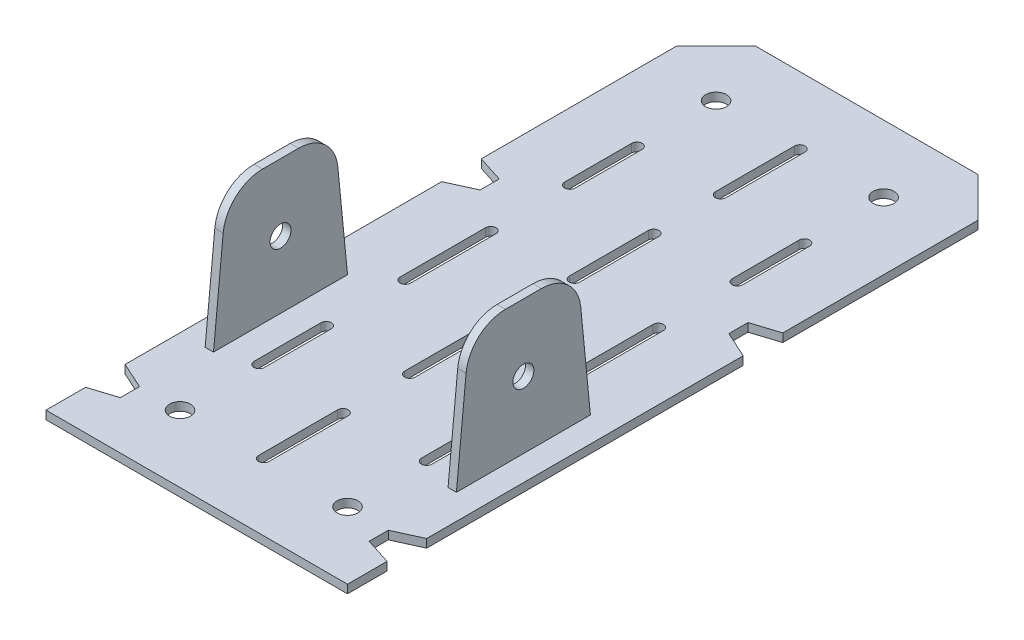
from build123d import *

# Parameters (mm, degrees)
SKETCH1_W           = 114.3
SKETCH1_H           = 254
BOSS_EXTRUDE1_DEPTH = 1.5875
SKETCH2_W           = 3.175
SKETCH2_H           = 50.8
BOSS_EXTRUDE2_DEPTH = 50.8
CUT_EXTRUDE1_DEPTH  = 50
SKETCH4_R           = 3.96875
CUT_EXTRUDE2_DEPTH  = 50
SKETCH5_R           = 3.96875
CUT_EXTRUDE3_DEPTH  = 100
CHAMFER1_SIZE       = 15
FILLET1_R           = 15


with BuildPart() as part:
    # Sketch1 → Boss-Extrude1 (new, symmetric)
    with BuildSketch(Plane(origin=(0, 0, 0), x_dir=(1, 0, 0), z_dir=(0, 1, 0))):
        Rectangle(SKETCH1_W, SKETCH1_H)
    extrude(amount=BOSS_EXTRUDE1_DEPTH, both=True)

    # Sketch2 → Boss-Extrude2 (add)
    with BuildSketch(Plane(origin=(0, 1.5875, 0), x_dir=(1, 0, 0), z_dir=(0, 1, 0))):
        with Locations((46.0375, -50.8)):
            Rectangle(SKETCH2_W, SKETCH2_H)
        with Locations((-46.0375, -50.8)):
            Rectangle(SKETCH2_W, SKETCH2_H)
    extrude(amount=BOSS_EXTRUDE2_DEPTH)

    # Sketch3 → Cut-Extrude1 (cut, symmetric)
    with BuildSketch(Plane(origin=(0, 0, 0), x_dir=(0, 0, -1), z_dir=(1, 0, 0))):
        Polygon((-25.4, 1.5875), (-25.4, 52.3875), (-30.4, 52.3875), align=None)
        Polygon((-76.2, 52.3875), (-71.2, 52.3875), (-76.2, 1.5875), align=None)
    extrude(amount=CUT_EXTRUDE1_DEPTH, both=True, mode=Mode.SUBTRACT)

    # Sketch4 → Cut-Extrude2 (cut, symmetric)
    with BuildSketch(Plane(origin=(0, 0, 0), x_dir=(0, 0, -1), z_dir=(1, 0, 0))):
        with Locations((-50.8, 26.9875)):
            Circle(SKETCH4_R)
    extrude(amount=CUT_EXTRUDE2_DEPTH, both=True, mode=Mode.SUBTRACT)

    # Sketch5 → Cut-Extrude3 (cut)
    with BuildSketch(Plane(origin=(0, 1.5875, 0), x_dir=(1, 0, 0), z_dir=(0, 1, 0))):
        with Locations(Location((31.75, -101.6, 0), (0, 0, 270))):
            Circle(SKETCH5_R)
        with Locations(Location((-31.75, -101.6, 0), (0, 0, 270))):
            Circle(SKETCH5_R)
        with Locations(Location((31.75, 101.6, 0), (0, 0, 270))):
            Circle(SKETCH5_R)
        with Locations(Location((-31.75, 101.6, 0), (0, 0, 270))):
            Circle(SKETCH5_R)
        with Locations(Location((0, 0, 0), (0, 0, 270))):
            Circle(SKETCH5_R)
        with BuildLine():
            Line((-1.984375, -101.6), (-1.984375, -71.6))
            ThreePointArc((-1.984375, -71.6), (0, -69.615625), (1.984375, -71.6))
            Line((1.984375, -71.6), (1.984375, -101.6))
            ThreePointArc((1.984375, -101.6), (0, -103.584375), (-1.984375, -101.6))
        make_face()
        with BuildLine():
            Line((-1.984375, -46.2), (-1.984375, -16.2))
            ThreePointArc((-1.984375, -16.2), (0, -14.215625), (1.984375, -16.2))
            Line((1.984375, -16.2), (1.984375, -46.2))
            ThreePointArc((1.984375, -46.2), (0, -48.184375), (-1.984375, -46.2))
        make_face()
        with BuildLine():
            Line((-1.984375, 16.2), (-1.984375, 46.2))
            ThreePointArc((-1.984375, 46.2), (0, 48.184375), (1.984375, 46.2))
            Line((1.984375, 46.2), (1.984375, 16.2))
            ThreePointArc((1.984375, 16.2), (0, 14.215625), (-1.984375, 16.2))
        make_face()
        with BuildLine():
            Line((-1.984375, 71.6), (-1.984375, 101.6))
            ThreePointArc((-1.984375, 101.6), (0, 103.584375), (1.984375, 101.6))
            Line((1.984375, 101.6), (1.984375, 71.6))
            ThreePointArc((1.984375, 71.6), (0, 69.615625), (-1.984375, 71.6))
        make_face()
        with BuildLine():
            Line((33.734375, -46.2), (33.734375, -71.6))
            ThreePointArc((33.734375, -71.6), (31.75, -73.584375), (29.765625, -71.6))
            Line((29.765625, -71.6), (29.765625, -46.2))
            ThreePointArc((29.765625, -46.2), (31.75, -44.215625), (33.734375, -46.2))
        make_face()
        with BuildLine():
            Line((33.734375, 16.2), (33.734375, -16.2))
            ThreePointArc((33.734375, -16.2), (31.75, -18.184375), (29.765625, -16.2))
            Line((29.765625, -16.2), (29.765625, 16.2))
            ThreePointArc((29.765625, 16.2), (31.75, 18.184375), (33.734375, 16.2))
        make_face()
        with BuildLine():
            Line((33.734375, 71.6), (33.734375, 46.2))
            ThreePointArc((33.734375, 46.2), (31.75, 44.215625), (29.765625, 46.2))
            Line((29.765625, 46.2), (29.765625, 71.6))
            ThreePointArc((29.765625, 71.6), (31.75, 73.584375), (33.734375, 71.6))
        make_face()
        with BuildLine():
            Line((-29.765625, -46.2), (-29.765625, -71.6))
            ThreePointArc((-29.765625, -71.6), (-31.75, -73.584375), (-33.734375, -71.6))
            Line((-33.734375, -71.6), (-33.734375, -46.2))
            ThreePointArc((-33.734375, -46.2), (-31.75, -44.215625), (-29.765625, -46.2))
        make_face()
        with BuildLine():
            Line((-29.765625, 16.2), (-29.765625, -16.2))
            ThreePointArc((-29.765625, -16.2), (-31.75, -18.184375), (-33.734375, -16.2))
            Line((-33.734375, -16.2), (-33.734375, 16.2))
            ThreePointArc((-33.734375, 16.2), (-31.75, 18.184375), (-29.765625, 16.2))
        make_face()
        with BuildLine():
            Line((-29.765625, 71.6), (-29.765625, 46.2))
            ThreePointArc((-29.765625, 46.2), (-31.75, 44.215625), (-33.734375, 46.2))
            Line((-33.734375, 46.2), (-33.734375, 71.6))
            ThreePointArc((-33.734375, 71.6), (-31.75, 73.584375), (-29.765625, 71.6))
        make_face()
        Polygon((57.15, 38), (57.15, 23), (47.15, 27.550166045), (47.15, 34.812409498), align=None)
        Polygon((-47.15, 27.550166045), (-57.15, 23), (-57.15, 38), (-47.15, 34.812409498), align=None)
        Polygon((47.15, -101.550166045), (57.15, -97), (57.15, -112), (47.15, -108.812409498), align=None)
        Polygon((-57.15, -112), (-57.15, -97), (-47.15, -101.550166045), (-47.15, -108.812409498), align=None)
    extrude(amount=-CUT_EXTRUDE3_DEPTH, mode=Mode.SUBTRACT)

    # Chamfer1
    chamfer1_edges = [part.edges().sort_by_distance(p)[0] for p in [
        (-57.15, 0, -127),
        (57.15, 0, -127),
    ]]
    chamfer(chamfer1_edges, length=CHAMFER1_SIZE)

    # Fillet1
    fillet1_edges = [part.edges().sort_by_distance(p)[0] for p in [
        (-46.0375, 52.3875, 71.2),
        (-46.0375, 52.3875, 30.4),
        (46.0375, 52.3875, 30.4),
        (46.0375, 52.3875, 71.2),
    ]]
    fillet(fillet1_edges, radius=FILLET1_R)


solid = part.part
